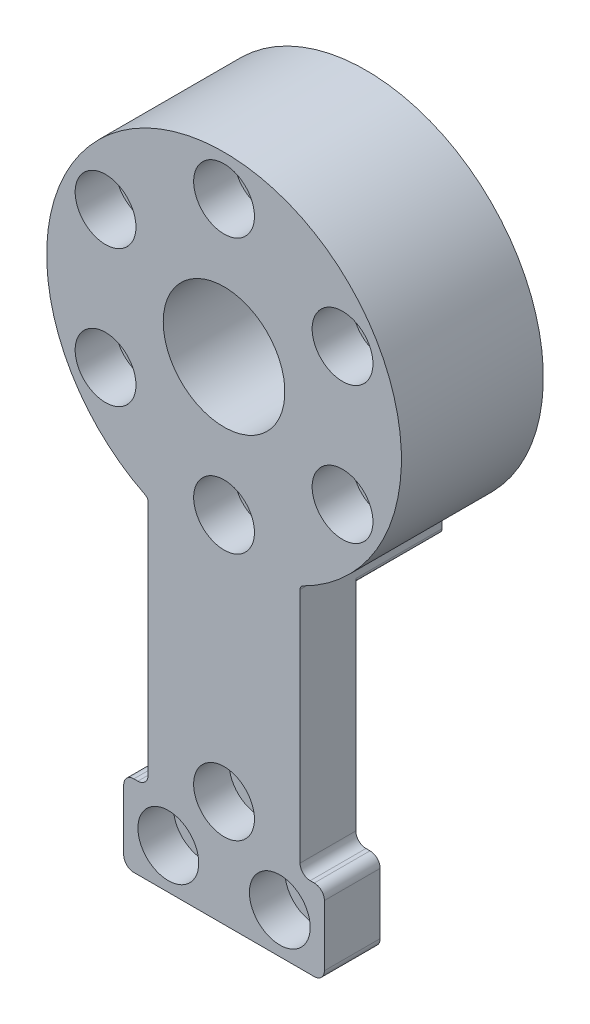
from build123d import *

# Parameters (mm, degrees)
EXTRUDE_1_DEPTH              = 14
CUT_EXTRUDE_1_DEPTH          = 8.5
SKETCH_3_W                   = 5.5
SKETCH_3_H                   = 7.999
EXTRUDE_2_DEPTH              = 2.4
SKETCH_4_W                   = 5.5
SKETCH_4_H                   = 7.999
EXTRUDE_3_DEPTH              = 2.4
HOLE_WIZARD_12_0_12_1_D      = 12
HOLE_WIZARD_M3_1_D           = 3.2
HOLE_WIZARD_M3_1_CBORE_D     = 6
HOLE_WIZARD_M3_1_CBORE_DEPTH = 4
HOLE_WIZARD_M3_2_D           = 3.2
HOLE_WIZARD_M3_2_DEPTH       = 14
HOLE_WIZARD_M3_2_CBORE_D     = 6
HOLE_WIZARD_M3_2_CBORE_DEPTH = 3.5
FILLET_1_R                   = 0.5
FILLET_2_R                   = 1


with BuildPart() as part:
    # 草图1 → 凸台-拉伸1 (new body)
    with BuildSketch(Plane.XY.offset(14)):
        with BuildLine():
            Line((-7.5, -15.811388301), (-7.5, -48.5))
            Line((-7.5, -48.5), (7.5, -48.5))
            Line((7.5, -48.5), (7.5, -15.811388301))
            ThreePointArc((7.5, -15.811388301), (0, 17.5), (-7.5, -15.811388301))
        make_face()
    extrude(amount=-EXTRUDE_1_DEPTH)

    # 草图2 → 切除-拉伸1 (cut)
    with BuildSketch(Plane(origin=(0, 0, 0), x_dir=(-1, 0, 0), z_dir=(0, 0, -1))):
        with BuildLine():
            Line((7.5, -48.5), (7.5, -18.270536391))
            ThreePointArc((7.5, -18.270536391), (0, -19.75), (-7.5, -18.270536391))
            Line((-7.5, -18.270536391), (-7.5, -48.5))
            Line((-7.5, -48.5), (7.5, -48.5))
        make_face()
    extrude(amount=-CUT_EXTRUDE_1_DEPTH, mode=Mode.SUBTRACT)

    # 草图3 → 凸台-拉伸2 (add)
    with BuildSketch(Plane.ZY.offset(7.5)):
        with Locations((11.25, -44.5005)):
            Rectangle(SKETCH_3_W, SKETCH_3_H)
    extrude(amount=EXTRUDE_2_DEPTH)

    # 草图4 → 凸台-拉伸3 (add)
    with BuildSketch(Plane(origin=(7.5, 0, 0), x_dir=(0, 0, -1), z_dir=(1, 0, 0))):
        with Locations((-11.25, -44.5005)):
            Rectangle(SKETCH_4_W, SKETCH_4_H)
    extrude(amount=EXTRUDE_3_DEPTH)

    # Ø12.0 (12) 直径孔1 (through all)
    with Locations(Plane(origin=(0, 0, 0), x_dir=(-1, 0, 0), z_dir=(0, 0, -1))):
        with Locations((0, 0)):
            Hole(HOLE_WIZARD_12_0_12_1_D / 2)

    # M3 六角头机械螺钉的柱形沉头孔1 (through all)
    with Locations(Plane.XY.offset(14)):
        with Locations((0, 13.5), (11.691342951, 6.75), (11.691342951, -6.75), (0, -13.5), (-11.691342951, -6.75), (-11.691342951, 6.75)):
            CounterBoreHole(HOLE_WIZARD_M3_1_D / 2, HOLE_WIZARD_M3_1_CBORE_D / 2, HOLE_WIZARD_M3_1_CBORE_DEPTH)

    # M3 六角头机械螺钉的柱形沉头孔2
    with Locations(Plane.XY.offset(14)):
        with Locations((0, -38), (5.501, -44.5005), (-5.499, -44.5005)):
            CounterBoreHole(HOLE_WIZARD_M3_2_D / 2, HOLE_WIZARD_M3_2_CBORE_D / 2, HOLE_WIZARD_M3_2_CBORE_DEPTH, depth=HOLE_WIZARD_M3_2_DEPTH)

    # 圆角1
    fillet_1_edges = [part.edges().sort_by_distance(p)[0] for p in [
        (7.5, -18.270536391, 4.25),
        (-7.5, -18.270536391, 4.25),
        (7.5, -15.811388301, 7),
        (-7.5, -15.811388301, 7),
    ]]
    fillet(fillet_1_edges, radius=FILLET_1_R)

    # 圆角2
    fillet_2_edges = [part.edges().sort_by_distance(p)[0] for p in [
        (-7.5, -40.501, 11.25),
        (-9.9, -40.501, 11.25),
        (-9.9, -48.5, 11.25),
        (7.5, -40.501, 11.25),
        (9.9, -40.501, 11.25),
        (9.9, -48.5, 11.25),
    ]]
    fillet(fillet_2_edges, radius=FILLET_2_R)


solid = part.part
